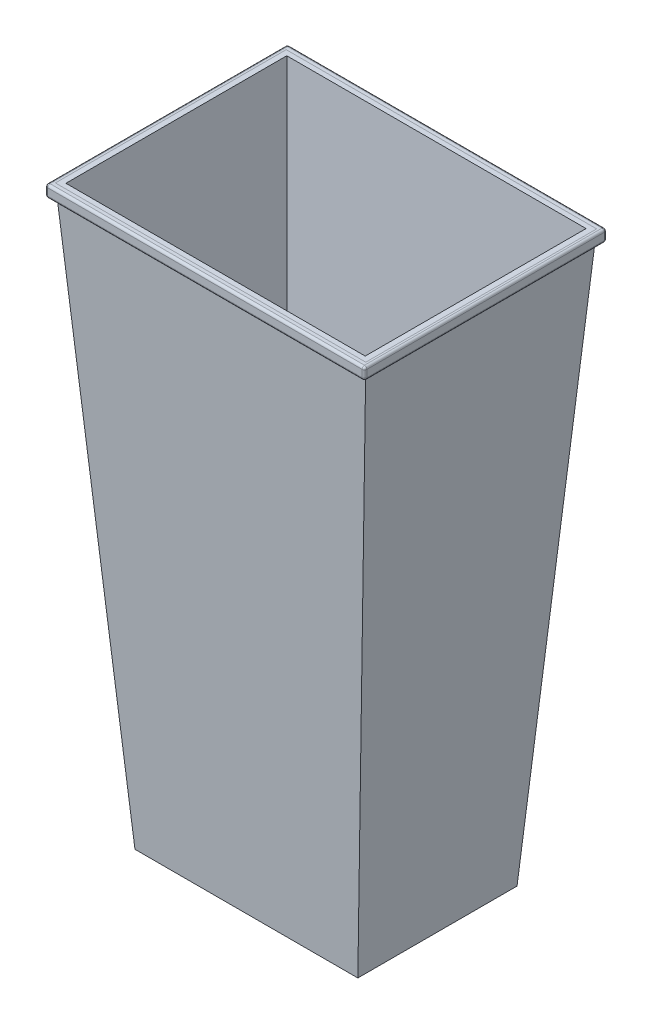
from build123d import *

# Parameters (mm, degrees)
CROQUIS1_W              = 280
CROQUIS1_H              = 200
SALIENTE_EXTRUIR1_DEPTH = 10
CROQUIS3_W              = 376.00434192
CROQUIS3_H              = 277.471683716
CORTAR_EXTRUIR1_DEPTH   = 710
CORTAR_EXTRUIR1_DRAFT   = -4
CROQUIS4_W              = 401.049923566
CROQUIS4_H              = 304.259280942
CROQUIS4_W_2            = 390
CROQUIS4_H_2            = 290
SALIENTE_EXTRUIR2_DEPTH = 15
REDONDEO1_R             = 3


with BuildPart() as part:
    # Croquis1 → Saliente-Extruir1 (new body)
    with BuildSketch(Plane(origin=(0, 0, 0), x_dir=(1, 0, 0), z_dir=(0, 1, 0))):
        Rectangle(CROQUIS1_W, CROQUIS1_H)
    extrude(amount=SALIENTE_EXTRUIR1_DEPTH)

    # Croquis1<2> → Recubrir2 section 0
    with BuildSketch(Plane(origin=(0, 0, 0), x_dir=(1, 0, 0), z_dir=(0, 1, 0))):
        with BuildLine():
            Line((-140, 100), (140, 100))
            Line((140, 100), (140, -100))
            Line((140, -100), (-140, -100))
            Line((-140, -100), (-140, 100))
        make_face()
    # Croquis2 → Recubrir2 section 1
    with BuildSketch(Plane(origin=(0, 720, 0), x_dir=(1, 0, 0), z_dir=(0, 1, 0))):
        with BuildLine():
            Line((-195, 145), (195, 145))
            Line((195, 145), (195, -145))
            Line((195, -145), (-195, -145))
            Line((-195, -145), (-195, 145))
        make_face()
    loft()


with BuildPart() as cortar_extruir1_tool:
    # Croquis3 → Cortar-Extruir1 (with draft: the straight prism first)
    with BuildSketch(Plane(origin=(0, 720, 0), x_dir=(1, 0, 0), z_dir=(0, 1, 0))):
        Rectangle(CROQUIS3_W, CROQUIS3_H)
    extrude(amount=-CORTAR_EXTRUIR1_DEPTH)
    # Cortar-Extruir1: the draft: its side faces are tilted about the plane it starts from
    cortar_extruir1_sides = [cortar_extruir1_tool.faces().sort_by_distance(p)[0] for p in [
        (-188.00217096, 365, 0),
        (0, 365, 138.735841858),
        (188.00217096, 365, 0),
        (0, 365, -138.735841858),
    ]]
    draft(cortar_extruir1_sides, Plane(origin=(0, 720, 0), x_dir=(1, 0, 0), z_dir=(0, 1, 0)), CORTAR_EXTRUIR1_DRAFT)


with BuildPart() as part_1:
    add(part.part)

    # Cortar-Extruir1: cut by cortar_extruir1_tool
    add(cortar_extruir1_tool.part, mode=Mode.SUBTRACT)


with BuildPart() as body_2:
    # Croquis4 → Saliente-Extruir2 (new body)
    with BuildSketch(Plane(origin=(0, 720, 0), x_dir=(1, 0, 0), z_dir=(0, 1, 0))):
        Rectangle(CROQUIS4_W, CROQUIS4_H)
        Rectangle(CROQUIS4_W_2, CROQUIS4_H_2, mode=Mode.SUBTRACT)
    extrude(amount=-SALIENTE_EXTRUIR2_DEPTH)

    # Redondeo1
    redondeo1_edges = [body_2.edges().sort_by_distance(p)[0] for p in [
        (200.524961783, 712.5, -152.129640471),
        (0, 705, -152.129640471),
        (0, 720, -152.129640471),
        (-200.524961783, 712.5, -152.129640471),
        (-200.524961783, 712.5, 152.129640471),
        (200.524961783, 712.5, 152.129640471),
        (200.524961783, 705, 0),
        (200.524961783, 720, 0),
        (-200.524961783, 705, 0),
        (0, 705, 152.129640471),
        (-200.524961783, 720, 0),
        (0, 720, 152.129640471),
    ]]
    fillet(redondeo1_edges, radius=REDONDEO1_R)


solid = Compound([part_1.part, body_2.part])
